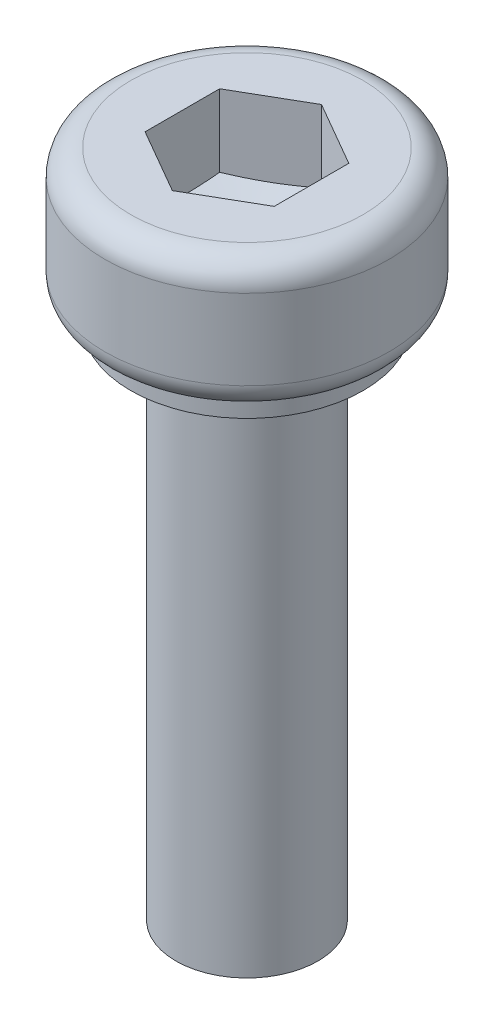
from build123d import *

# Parameters (mm, degrees)
BOSS_EXTRUDE1_DEPTH = 2


with BuildPart() as part:
    # Sketch1 → Revolve1 (revolve)
    with BuildSketch(Plane.XY):
        with BuildLine():
            Line((0, 6.475), (2.25, 6.475))
            ThreePointArc((2.25, 6.475), (2.603553391, 6.328553391), (2.75, 5.975))
            Line((2.75, 5.975), (2.75, 4.425))
            ThreePointArc((2.75, 4.425), (2.603553391, 4.071446609), (2.25, 3.925))
            Line((2.25, 3.925), (2.25, 3.525))
            Line((2.25, 3.525), (1.375, 3.525))
            Line((1.375, 3.525), (1.375, -6.475))
            Line((1.375, -6.475), (0, -6.475))
            Line((0, -6.475), (0, 6.475))
        make_face()
    revolve(axis=Axis((0, 4.094224924, 0), (0, -1, 0)))


with BuildPart() as body_2:
    # Sketch2 → Boss-Extrude1 (new body)
    with BuildSketch(Plane(origin=(0, 6.475, 0), x_dir=(1, 0, 0), z_dir=(0, 1, 0))):
        Polygon((0, 1.443375673), (-1.25, 0.721687836), (-1.25, -0.721687836), (0, -1.443375673), (1.25, -0.721687836), (1.25, 0.721687836), align=None)
    extrude(amount=-BOSS_EXTRUDE1_DEPTH)

    # Sketch3 → Cut-Revolve1 (revolve, cut)
    with BuildSketch(Plane(origin=(0, 0, 0), x_dir=(0, 0, -1), z_dir=(1, 0, 0))):
        Polygon((0, 4.875), (0.4, 4.875), (1.443375673, 5.075), (1.443375673, 4.475), (0, 4.475), align=None)
    revolve(axis=Axis((0, 4.475, 0), (0, 1, 0)), mode=Mode.SUBTRACT)


with BuildPart() as part_1:
    add(part.part)

    # Combine1: cut body 2
    add(body_2.part, mode=Mode.SUBTRACT)


solid = part_1.part
